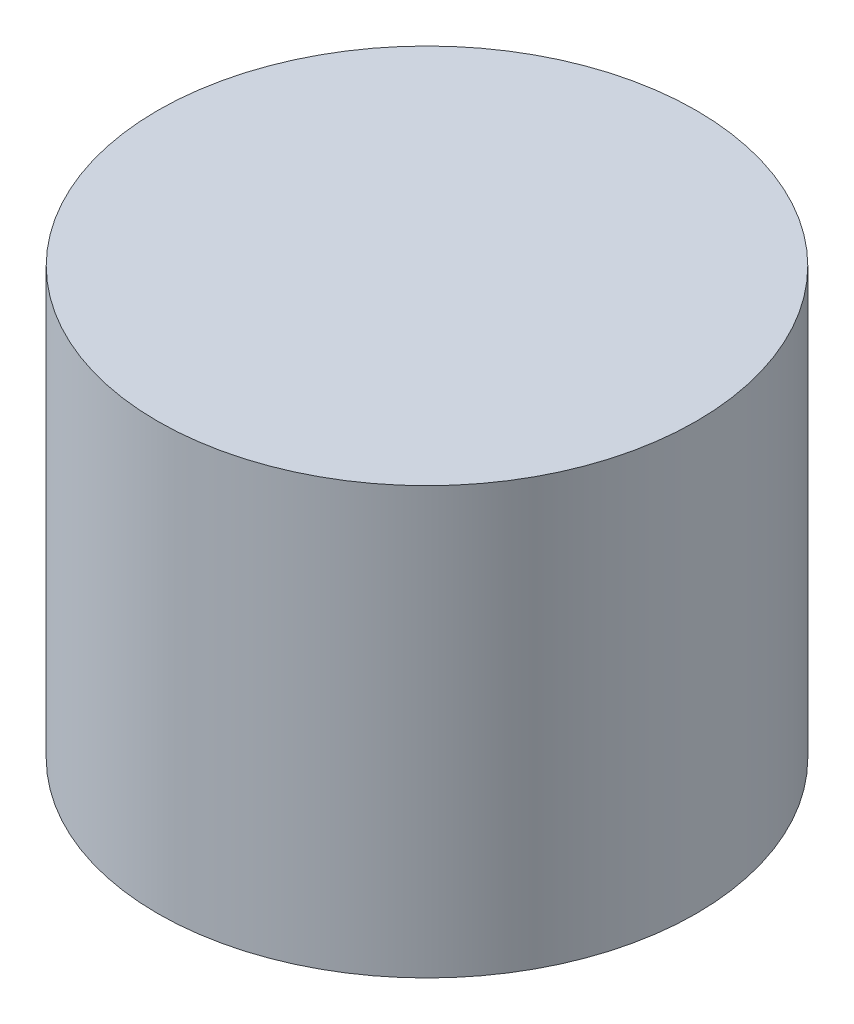
from build123d import *

# Parameters (mm, degrees)
SKETCH1_R           = 6
BOSS_EXTRUDE1_DEPTH = 9.5


with BuildPart() as part:
    # Sketch1 → Boss-Extrude1 (new body)
    with BuildSketch(Plane(origin=(0, 0, 0), x_dir=(1, 0, 0), z_dir=(0, 1, 0))):
        with Locations(Location((0, 0, 0), (0, 0, 270))):
            Circle(SKETCH1_R)
    extrude(amount=BOSS_EXTRUDE1_DEPTH)


solid = part.part
